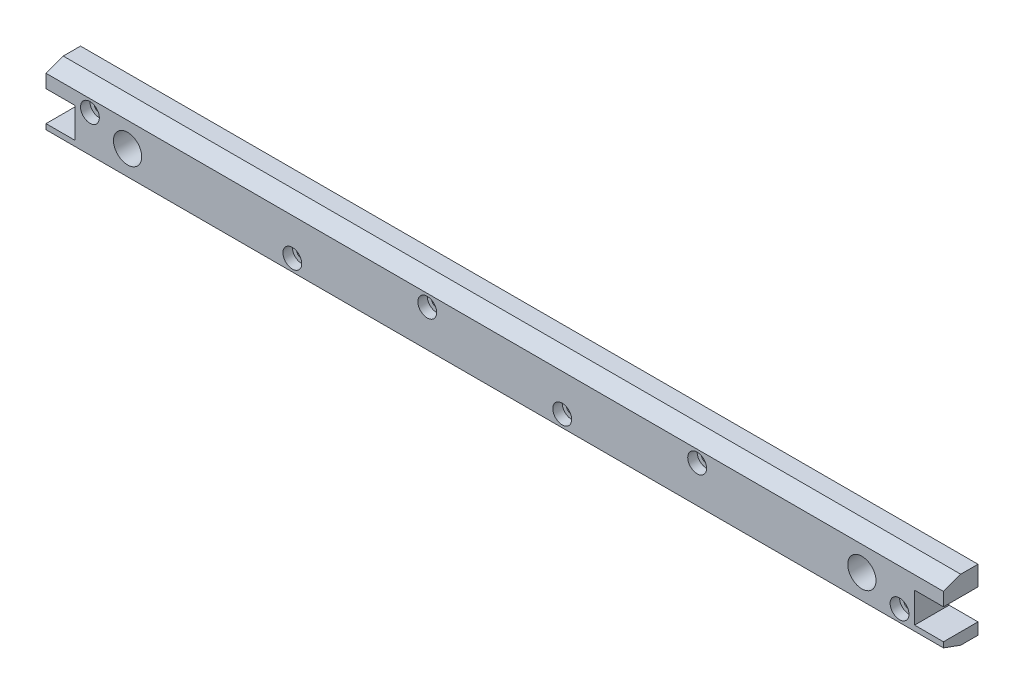
from build123d import *

# Parameters (mm, degrees)
SKIZZE1_R                          = 4.5
SKIZZE1_R_2                        = 1.65
AUFSATZ_LINEAR_AUSTRAGEN1_DEPTH    = 8
SKIZZE2_R                          = 4.5
SKIZZE2_R_2                        = 1.65
AUFSATZ_LINEAR_AUSTRAGEN2_DEPTH    = 3
FASE1_SIZE                         = 2
FASE1_SIZE2                        = 5.494954839
SKIZZE3_R                          = 3
SCHNITT_LINEAR_AUSTRAGEN1_DEPTH    = 3
K_RPER_VERSCHIEBEN_KOPIEREN1_ANGLE = 90


with BuildPart() as part:
    # Skizze1 → Aufsatz-Linear austragen1 (new body)
    with BuildSketch(Plane(origin=(0, 0, 0), x_dir=(1, 0, 0), z_dir=(0, 1, 0))):
        Polygon((286, 0), (286, -6.26), (276.8, -6.26), (276.8, -15.9), (286, -15.9), (286, -19.6), (0, -19.6), (0, -15.9), (9.2, -15.9), (9.2, -6.26), (0, -6.26), (0, 0), align=None)
        with Locations(Location((260, -9.8, 0), (0, 0, 270))):
            Circle(SKIZZE1_R, mode=Mode.SUBTRACT)
        with Locations(Location((26, -9.8, 0), (0, 0, 270))):
            Circle(SKIZZE1_R, mode=Mode.SUBTRACT)
        with Locations(Location((14, -5.8, 0), (0, 0, 270))):
            Circle(SKIZZE1_R_2, mode=Mode.SUBTRACT)
        with Locations(Location((78.5, -13.8, 0), (0, 0, 270))):
            Circle(SKIZZE1_R_2, mode=Mode.SUBTRACT)
        with Locations(Location((121.5, -5.8, 0), (0, 0, 270))):
            Circle(SKIZZE1_R_2, mode=Mode.SUBTRACT)
        with Locations(Location((164.5, -13.8, 0), (0, 0, 270))):
            Circle(SKIZZE1_R_2, mode=Mode.SUBTRACT)
        with Locations(Location((207.5, -5.8, 0), (0, 0, 270))):
            Circle(SKIZZE1_R_2, mode=Mode.SUBTRACT)
        with Locations(Location((272, -13.8, 0), (0, 0, 270))):
            Circle(SKIZZE1_R_2, mode=Mode.SUBTRACT)
        Polygon((200.330127019, -2.3), (204.660254038, -9.8), (200.330127019, -17.3), (171.669872981, -17.3), (167.339745962, -9.8), (171.669872981, -2.3), align=None, mode=Mode.SUBTRACT)
        Polygon((243.330127019, -2.3), (247.660254038, -9.8), (243.330127019, -17.3), (214.669872981, -17.3), (210.339745962, -9.8), (214.669872981, -2.3), align=None, mode=Mode.SUBTRACT)
        Polygon((81.339745962, -9.8), (85.669872981, -2.3), (114.330127019, -2.3), (118.660254038, -9.8), (114.330127019, -17.3), (85.669872981, -17.3), align=None, mode=Mode.SUBTRACT)
        Polygon((38.339745962, -9.8), (42.669872981, -2.3), (71.330127019, -2.3), (75.660254038, -9.8), (71.330127019, -17.3), (42.669872981, -17.3), align=None, mode=Mode.SUBTRACT)
        Polygon((128.669872981, -2.3), (157.330127019, -2.3), (161.660254038, -9.8), (157.330127019, -17.3), (128.669872981, -17.3), (124.339745962, -9.8), align=None, mode=Mode.SUBTRACT)
    extrude(amount=AUFSATZ_LINEAR_AUSTRAGEN1_DEPTH)

    # Skizze2 → Aufsatz-Linear austragen2 (add)
    with BuildSketch(Plane(origin=(0, 8, 0), x_dir=(1, 0, 0), z_dir=(0, 1, 0))):
        Polygon((0, -19.6), (286, -19.6), (286, -15.9), (276.8, -15.9), (276.8, -6.26), (286, -6.26), (286, 0), (0, 0), (0, -6.26), (9.2, -6.26), (9.2, -15.9), (0, -15.9), align=None)
        with Locations(Location((260, -9.8, 0), (0, 0, 270))):
            Circle(SKIZZE2_R, mode=Mode.SUBTRACT)
        with Locations(Location((26, -9.8, 0), (0, 0, 270))):
            Circle(SKIZZE2_R, mode=Mode.SUBTRACT)
        with Locations(Location((272, -13.8, 0), (0, 0, 270))):
            Circle(SKIZZE2_R_2, mode=Mode.SUBTRACT)
        with Locations(Location((207.5, -5.8, 0), (0, 0, 270))):
            Circle(SKIZZE2_R_2, mode=Mode.SUBTRACT)
        with Locations(Location((164.5, -13.8, 0), (0, 0, 270))):
            Circle(SKIZZE2_R_2, mode=Mode.SUBTRACT)
        with Locations(Location((78.5, -13.8, 0), (0, 0, 270))):
            Circle(SKIZZE2_R_2, mode=Mode.SUBTRACT)
        with Locations(Location((121.5, -5.8, 0), (0, 0, 270))):
            Circle(SKIZZE2_R_2, mode=Mode.SUBTRACT)
        with Locations(Location((14, -5.8, 0), (0, 0, 270))):
            Circle(SKIZZE2_R_2, mode=Mode.SUBTRACT)
    extrude(amount=AUFSATZ_LINEAR_AUSTRAGEN2_DEPTH)

    # Fase1
    fase1_edges = [part.edges().sort_by_distance(p)[0] for p in [
        (143, 11, 19.6),
        (143, 11, 0),
    ]]
    fase1_side = [part.faces().sort_by_distance(p)[0] for p in [
        (143, 11, 9.756751336),
    ]]
    chamfer(fase1_edges, length=FASE1_SIZE, length2=FASE1_SIZE2, reference=fase1_side[0])

    # Skizze3 → Schnitt-Linear austragen1 (cut)
    with BuildSketch(Plane(origin=(0, 11, 0), x_dir=(1, 0, 0), z_dir=(0, 1, 0))):
        with Locations(Location((14, -5.8, 0), (0, 0, 270))):
            Circle(SKIZZE3_R)
        with Locations(Location((78.5, -13.8, 0), (0, 0, 270))):
            Circle(SKIZZE3_R)
        with Locations(Location((121.5, -5.8, 0), (0, 0, 270))):
            Circle(SKIZZE3_R)
        with Locations(Location((164.5, -13.8, 0), (0, 0, 270))):
            Circle(SKIZZE3_R)
        with Locations(Location((207.5, -5.8, 0), (0, 0, 270))):
            Circle(SKIZZE3_R)
        with Locations(Location((272, -13.8, 0), (0, 0, 270))):
            Circle(SKIZZE3_R)
    extrude(amount=-SCHNITT_LINEAR_AUSTRAGEN1_DEPTH, mode=Mode.SUBTRACT)


with BuildPart() as part_1:
    # Körper-Verschieben/Kopieren1: moved
    add(part.part.rotate(Axis((0, 5.5, 9.8), (1, 0, 0)), K_RPER_VERSCHIEBEN_KOPIEREN1_ANGLE))


solid = part_1.part
